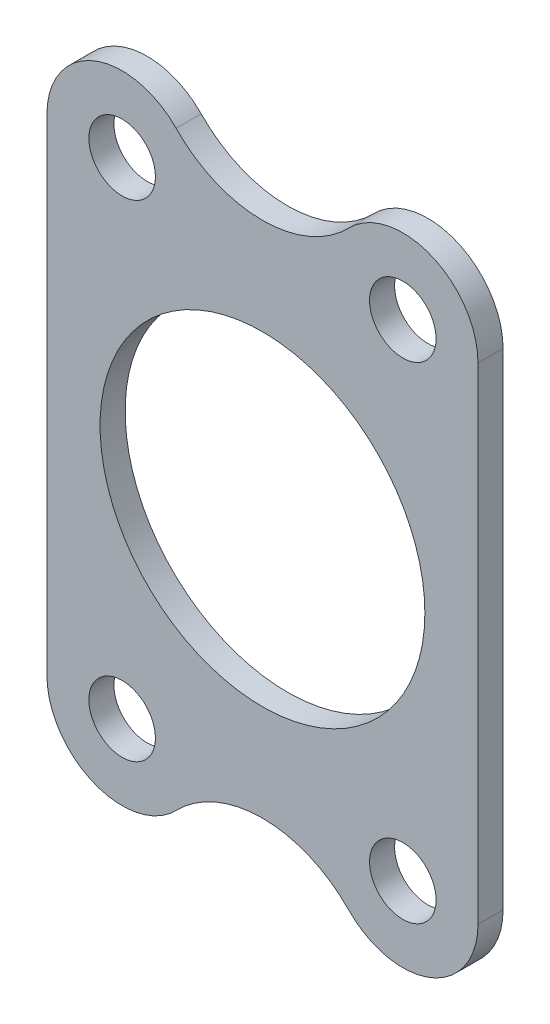
from build123d import *

# Parameters (mm, degrees)
SKETCH1_R           = 2.1082
SKETCH1_R_2         = 10.287
BOSS_EXTRUDE1_DEPTH = 1.5875


with BuildPart() as part:
    # Sketch1 → Boss-Extrude1 (new body)
    with BuildSketch(Plane.XY.offset(16.51)):
        with BuildLine():
            Line((13.6525, -15.397931679), (13.6525, 15.397931679))
            ThreePointArc((13.6525, 15.397931679), (10.678479761, 19.811858094), (5.470769231, 18.71308887))
            ThreePointArc((5.470769231, 18.71308887), (0, 16.397340374), (-5.470769231, 18.71308887))
            ThreePointArc((-5.470769231, 18.71308887), (-10.678479761, 19.811858094), (-13.6525, 15.397931679))
            Line((-13.6525, 15.397931679), (-13.6525, -15.397931679))
            ThreePointArc((-13.6525, -15.397931679), (-10.678479761, -19.811858094), (-5.470769231, -18.71308887))
            ThreePointArc((-5.470769231, -18.71308887), (0, -16.397340374), (5.470769231, -18.71308887))
            ThreePointArc((5.470769231, -18.71308887), (10.678479761, -19.811858094), (13.6525, -15.397931679))
        make_face()
        with Locations((8.89, -15.397931679)):
            Circle(SKETCH1_R, mode=Mode.SUBTRACT)
        with Locations((-8.89, -15.397931679)):
            Circle(SKETCH1_R, mode=Mode.SUBTRACT)
        Circle(SKETCH1_R_2, mode=Mode.SUBTRACT)
        with Locations((8.89, 15.397931679)):
            Circle(SKETCH1_R, mode=Mode.SUBTRACT)
        with Locations((-8.89, 15.397931679)):
            Circle(SKETCH1_R, mode=Mode.SUBTRACT)
    extrude(amount=BOSS_EXTRUDE1_DEPTH)


solid = part.part
